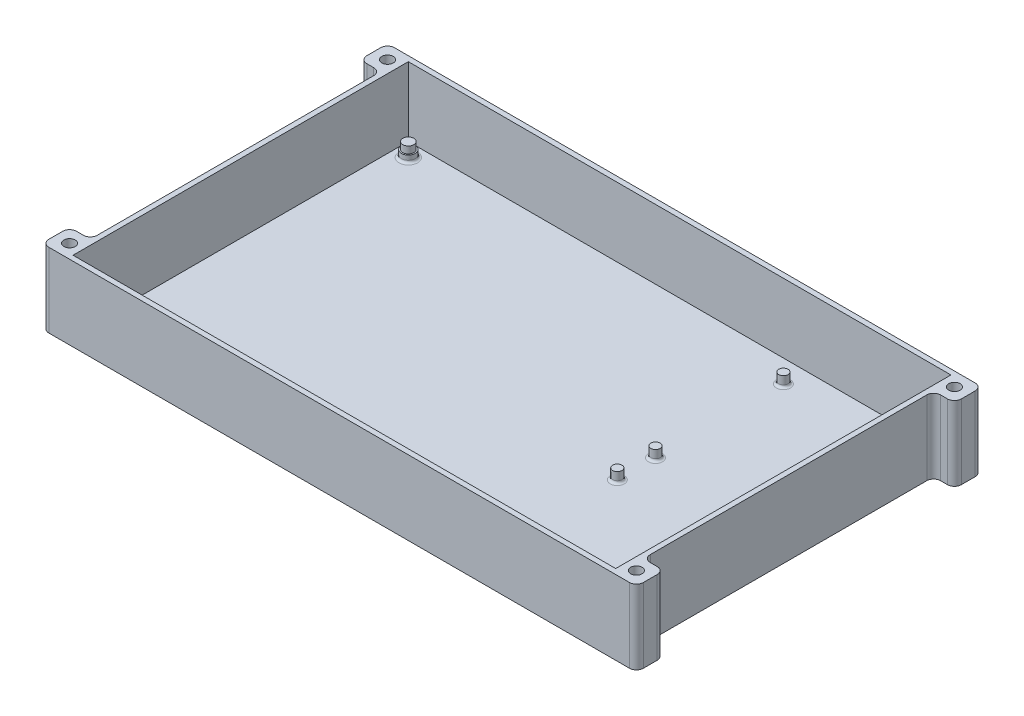
from build123d import *

# Parameters (mm, degrees)
SKETCH1_W           = 160
SKETCH1_H           = 100
SKETCH1_W_2         = 157
SKETCH1_H_2         = 97
BOSS_EXTRUDE1_DEPTH = 20
SKETCH2_W           = 160
SKETCH2_H           = 100
BOSS_EXTRUDE2_DEPTH = 1.5
SKETCH3_R           = 2
BOSS_EXTRUDE3_DEPTH = 2
SKETCH4_R           = 1.6
BOSS_EXTRUDE4_DEPTH = 2
SKETCH5_R           = 1.35
BOSS_EXTRUDE5_DEPTH = 3
FILLET1_R           = 0.7
SKETCH8_W           = 8
SKETCH8_H           = 8
SKETCH8_R           = 1.65
BOSS_EXTRUDE7_DEPTH = 21.5
FILLET2_R           = 2
SKETCH9_W           = 0.5
SKETCH9_H           = 8
CUT_EXTRUDE1_DEPTH  = 22
FILLET3_R           = 2
CUT_EXTRUDE2_DEPTH  = 2.7


with BuildPart() as part:
    # Sketch1 → Boss-Extrude1 (new body)
    with BuildSketch(Plane(origin=(0, 0, 0), x_dir=(1, 0, 0), z_dir=(0, 1, 0))):
        with Locations((80, 50)):
            Rectangle(SKETCH1_W, SKETCH1_H)
        with Locations((80, 50)):
            Rectangle(SKETCH1_W_2, SKETCH1_H_2, mode=Mode.SUBTRACT)
    extrude(amount=BOSS_EXTRUDE1_DEPTH)

    # Sketch2 → Boss-Extrude2 (add)
    with BuildSketch(Plane.XZ):
        with Locations((80, -50)):
            Rectangle(SKETCH2_W, SKETCH2_H)
    extrude(amount=BOSS_EXTRUDE2_DEPTH)

    # Sketch3 → Boss-Extrude3 (add)
    with BuildSketch(Plane(origin=(0, 0, 0), x_dir=(1, 0, 0), z_dir=(0, 1, 0))):
        with Locations(Location((5.5, 5.5, 0), (0, 0, 90))):
            Circle(SKETCH3_R)
        with Locations(Location((5.5, 94.5, 0), (0, 0, 90))):
            Circle(SKETCH3_R)
        with Locations(Location((94.5, 5.5, 0), (0, 0, 90))):
            Circle(SKETCH3_R)
    extrude(amount=BOSS_EXTRUDE3_DEPTH)

    # Sketch4 → Boss-Extrude4 (add)
    with BuildSketch(Plane(origin=(0, 2, 0), x_dir=(1, 0, 0), z_dir=(0, 1, 0))):
        with Locations(Location((5.5, 5.5, 0), (0, 0, 270))):
            Circle(SKETCH4_R)
        with Locations(Location((94.5, 5.5, 0), (0, 0, 270))):
            Circle(SKETCH4_R)
        with Locations(Location((5.5, 94.5, 0), (0, 0, 90))):
            Circle(SKETCH4_R)
    extrude(amount=BOSS_EXTRUDE4_DEPTH)

    # Sketch5 → Boss-Extrude5 (add)
    with BuildSketch(Plane(origin=(0, 0, 0), x_dir=(1, 0, 0), z_dir=(0, 1, 0))):
        with Locations(Location((116.5, 92.027397936, 0), (0, 0, 90))):
            Circle(SKETCH5_R)
        with Locations(Location((116.5, 55.027397936, 0), (0, 0, 90))):
            Circle(SKETCH5_R)
        with Locations(Location((153.5, 55.027397936, 0), (0, 0, 90))):
            Circle(SKETCH5_R)
        with Locations(Location((153.5, 92.027397936, 0), (0, 0, 90))):
            Circle(SKETCH5_R)
        with Locations(Location((116.5, 43.968882069, 0), (0, 0, 90))):
            Circle(SKETCH5_R)
        with Locations(Location((153.5, 43.968882069, 0), (0, 0, 90))):
            Circle(SKETCH5_R)
        with Locations(Location((116.5, 6.968882069, 0), (0, 0, 90))):
            Circle(SKETCH5_R)
        with Locations(Location((153.5, 6.968882069, 0), (0, 0, 90))):
            Circle(SKETCH5_R)
    extrude(amount=BOSS_EXTRUDE5_DEPTH)

    # Fillet1
    fillet1_edges = [part.edges().sort_by_distance(p)[0] for p in [
        (5.5, 0, -3.5),
        (5.5, 0, -92.5),
        (94.5, 0, -3.5),
        (116.5, 0, -90.677397936),
        (116.5, 0, -53.677397936),
        (153.5, 0, -53.677397936),
        (153.5, 0, -90.677397936),
        (116.5, 0, -42.618882069),
        (153.5, 0, -42.618882069),
        (116.5, 0, -5.618882069),
        (153.5, 0, -5.618882069),
    ]]
    fillet(fillet1_edges, radius=FILLET1_R)

    # Sketch8 → Boss-Extrude7 (add)
    # profile 1 of 4: a face of its own
    with BuildSketch(Plane(origin=(0, 20, 0), x_dir=(1, 0, 0), z_dir=(0, 1, 0))):
        with Locations((-2.5, 96)):
            Rectangle(SKETCH8_W, SKETCH8_H)
        with Locations(Location((-2, 96, 0), (0, 0, 270))):
            Circle(SKETCH8_R, mode=Mode.SUBTRACT)
    # profile 2 of 4: a face of its own
    with BuildSketch(Plane(origin=(0, 20, 0), x_dir=(1, 0, 0), z_dir=(0, 1, 0))):
        with Locations((-2.5, 4)):
            Rectangle(SKETCH8_W, SKETCH8_H)
        with Locations(Location((-2, 4, 0), (0, 0, 90))):
            Circle(SKETCH8_R, mode=Mode.SUBTRACT)
    # profile 3 of 4: a face of its own
    with BuildSketch(Plane(origin=(0, 20, 0), x_dir=(1, 0, 0), z_dir=(0, 1, 0))):
        with Locations((162.5, 4)):
            Rectangle(SKETCH8_W, SKETCH8_H)
        with Locations(Location((162, 4, 0), (0, 0, 270))):
            Circle(SKETCH8_R, mode=Mode.SUBTRACT)
    # profile 4 of 4: a face of its own
    with BuildSketch(Plane(origin=(0, 20, 0), x_dir=(1, 0, 0), z_dir=(0, 1, 0))):
        with Locations((162.5, 96)):
            Rectangle(SKETCH8_W, SKETCH8_H)
        with Locations(Location((162, 96, 0), (0, 0, 90))):
            Circle(SKETCH8_R, mode=Mode.SUBTRACT)
    extrude(amount=-BOSS_EXTRUDE7_DEPTH)

    # Fillet2
    fillet2_edges = [part.edges().sort_by_distance(p)[0] for p in [
        (0, 9.25, -92),
        (160, 9.25, -8),
        (0, 9.25, -8),
        (160, 9.25, -92),
    ]]
    fillet(fillet2_edges, radius=FILLET2_R)

    # Sketch9 → Cut-Extrude1 (cut)
    with BuildSketch(Plane(origin=(0, 20, 0), x_dir=(1, 0, 0), z_dir=(0, 1, 0))):
        with Locations((-6.25, 96)):
            Rectangle(SKETCH9_W, SKETCH9_H)
        with Locations((-6.25, 4)):
            Rectangle(SKETCH9_W, SKETCH9_H)
        with Locations((166.25, 4)):
            Rectangle(SKETCH9_W, SKETCH9_H)
        with Locations((166.25, 96)):
            Rectangle(SKETCH9_W, SKETCH9_H)
    extrude(amount=-CUT_EXTRUDE1_DEPTH, mode=Mode.SUBTRACT)

    # Fillet3
    fillet3_edges = [part.edges().sort_by_distance(p)[0] for p in [
        (-6, 9.25, -8),
        (166, 9.25, -92),
        (166, 9.25, -100),
        (166, 9.25, 0),
        (166, 9.25, -8),
        (-6, 9.25, 0),
        (-6, 9.25, -100),
        (-6, 9.25, -92),
    ]]
    fillet(fillet3_edges, radius=FILLET3_R)

    # Sketch10 → Cut-Extrude2 (cut)
    with BuildSketch(Plane.XZ.offset(1.5)):
        Polygon((-2, -92.709103466), (-4.85, -94.354551733), (-4.85, -97.645448267), (-2, -99.290896534), (0.85, -97.645448267), (0.85, -94.354551733), align=None)
        Polygon((159.15, -94.354551733), (162, -92.709103466), (164.85, -94.354551733), (164.85, -97.645448267), (162, -99.290896534), (159.15, -97.645448267), align=None)
        Polygon((159.15, -2.354551733), (159.15, -5.645448267), (162, -7.290896534), (164.85, -5.645448267), (164.85, -2.354551733), (162, -0.709103466), align=None)
        Polygon((0.85, -5.645448267), (-2, -7.290896534), (-4.85, -5.645448267), (-4.85, -2.354551733), (-2, -0.709103466), (0.85, -2.354551733), align=None)
    extrude(amount=-CUT_EXTRUDE2_DEPTH, mode=Mode.SUBTRACT)


solid = part.part
